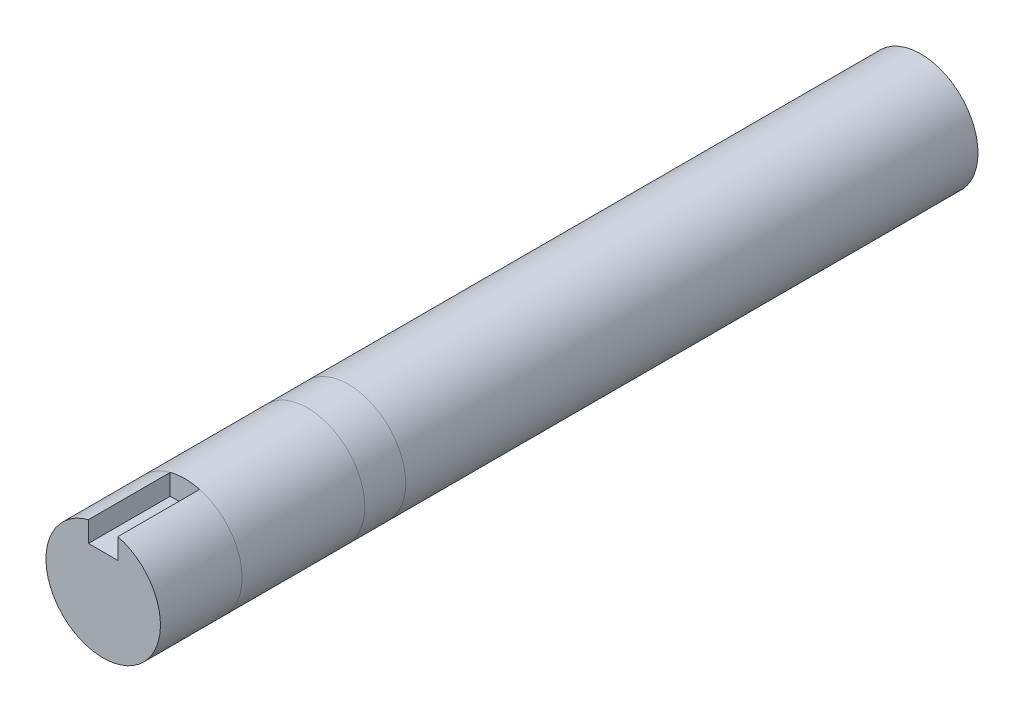
from build123d import *

# Parameters (mm, degrees)
SKETCH1_R           = 70
BOSS_EXTRUDE1_DEPTH = 1000
SKETCH3_W           = 36
SKETCH3_H           = 36
CUT_EXTRUDE1_DEPTH  = 100
EXTRUDE_THIN1_START = 50
SKETCH5_R           = 70
SKETCH5_R_2         = 69.9999
EXTRUDE_THIN1_DEPTH = 50


with BuildPart() as part:
    # Sketch1 → Boss-Extrude1 (new body)
    with BuildSketch(Plane.XY):
        Circle(SKETCH1_R)
    extrude(amount=-BOSS_EXTRUDE1_DEPTH)

    # Sketch3 → Cut-Extrude1 (cut)
    with BuildSketch(Plane.XY):
        with Locations((0, 60.4)):
            Rectangle(SKETCH3_W, SKETCH3_H)
    extrude(amount=-CUT_EXTRUDE1_DEPTH, mode=Mode.SUBTRACT)

    # Sketch5 → Extrude-Thin1 (add)
    with BuildSketch(Plane.XY.offset(-300).offset(EXTRUDE_THIN1_START)):
        Circle(SKETCH5_R)
        Circle(SKETCH5_R_2, mode=Mode.SUBTRACT)
    extrude(amount=-EXTRUDE_THIN1_DEPTH)


solid = part.part
